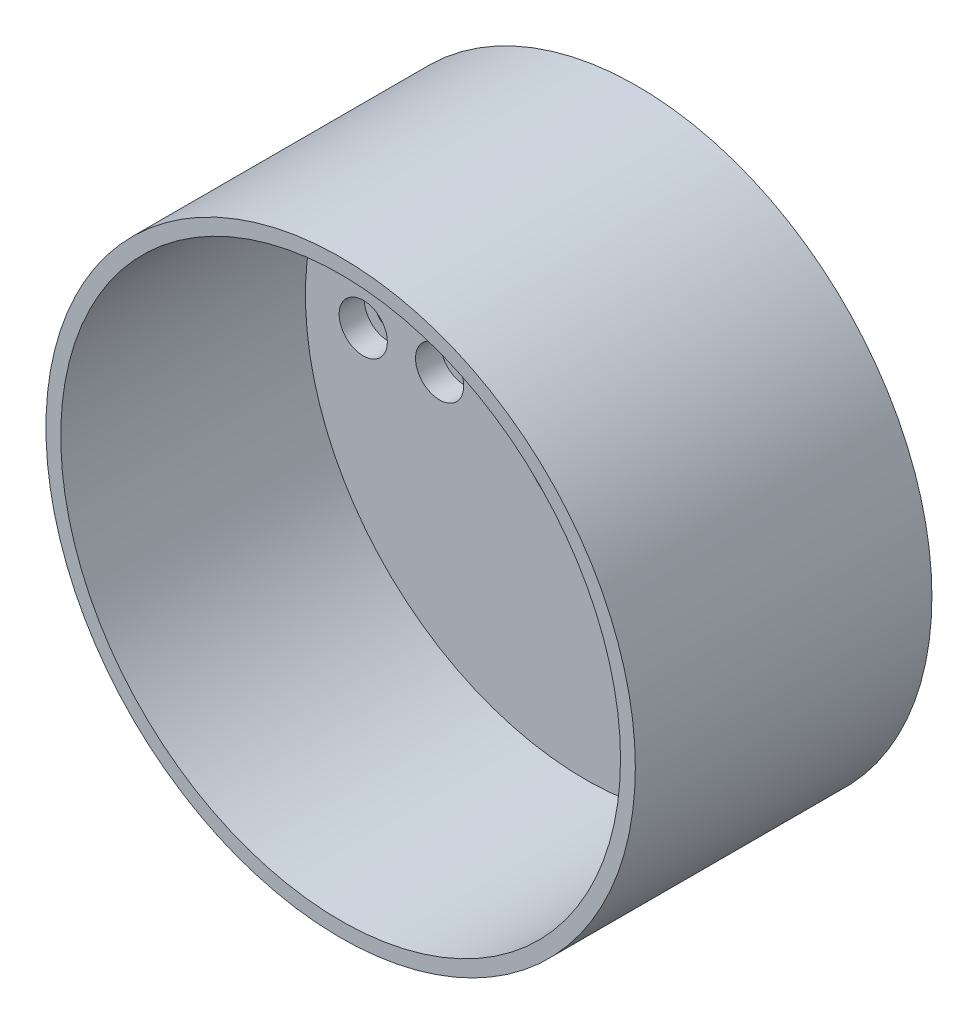
from build123d import *

# Parameters (mm, degrees)
SKETCH1_R                                       = 37.75
SKETCH1_R_2                                     = 9
BOSS_EXTRUDE1_DEPTH                             = 7
SKETCH1_5_R                                     = 39.75
SKETCH1_5_R_2                                   = 37.75
BOSS_EXTRUDE2_DEPTH                             = 40
CBORE_FOR_M3_SOCKET_HEAD_CAP_SCREW1_D           = 3.4
CBORE_FOR_M3_SOCKET_HEAD_CAP_SCREW1_CBORE_D     = 6.5
CBORE_FOR_M3_SOCKET_HEAD_CAP_SCREW1_CBORE_DEPTH = 3.4


with BuildPart() as part:
    # Sketch1 → Boss-Extrude1 (new body)
    with BuildSketch(Plane.XY):
        Circle(SKETCH1_R)
        Circle(SKETCH1_R_2, mode=Mode.SUBTRACT)
    extrude(amount=BOSS_EXTRUDE1_DEPTH)

    # Sketch1<5> → Boss-Extrude2 (add)
    with BuildSketch(Plane.XY):
        Circle(SKETCH1_5_R)
        Circle(SKETCH1_5_R_2, mode=Mode.SUBTRACT)
    extrude(amount=BOSS_EXTRUDE2_DEPTH)

    # CBORE for M3 Socket Head Cap Screw1 (through all)
    with Locations(Plane(origin=(-29.95, 0, 7), x_dir=(1, 0, 0), z_dir=(0, 0, 1))):
        with Locations((0, 0), (10.3, 0)):
            CounterBoreHole(CBORE_FOR_M3_SOCKET_HEAD_CAP_SCREW1_D / 2, CBORE_FOR_M3_SOCKET_HEAD_CAP_SCREW1_CBORE_D / 2, CBORE_FOR_M3_SOCKET_HEAD_CAP_SCREW1_CBORE_DEPTH)


solid = part.part
